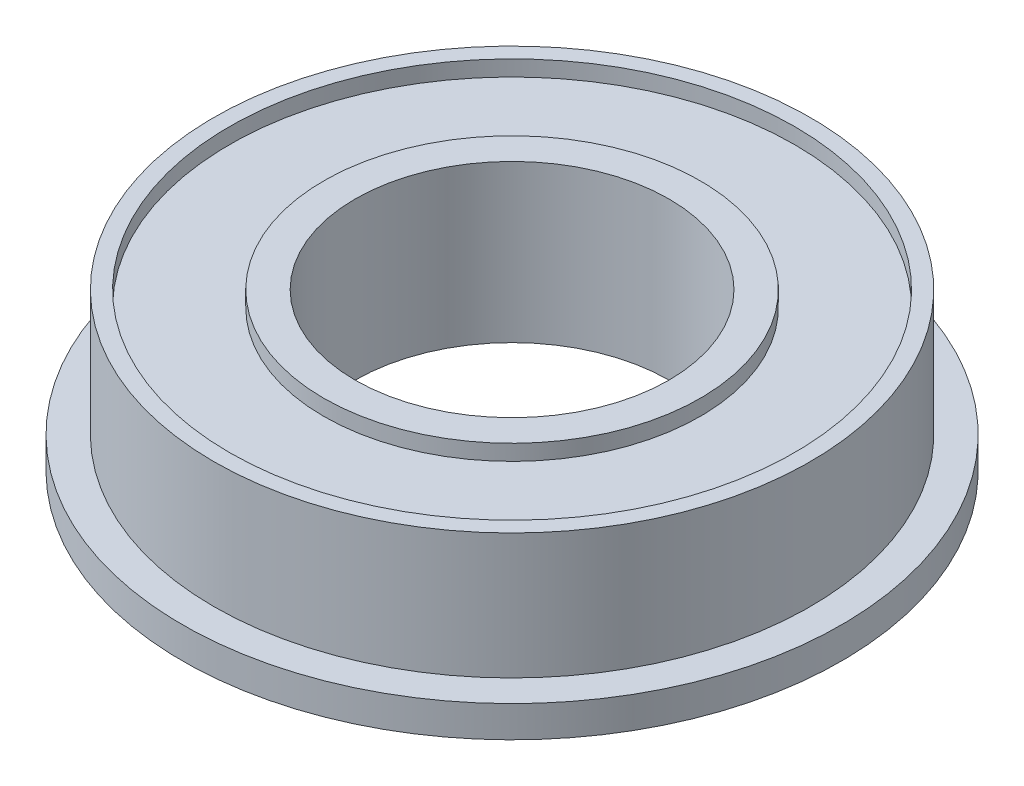
from build123d import *

# Parameters (mm, degrees)
SKETCH_1_R          = 9.5
EXTRUDE_1_DEPTH     = 4
SKETCH_2_R          = 10.5
EXTRUDE_2_DEPTH     = 1
CUT_EXTRUDE_1_REACH = 17.668
SKETCH_3_R          = 5
SKETCH_4_R          = 9
SKETCH_4_R_2        = 6
CUT_EXTRUDE_2_DEPTH = 0.5
CUT_EXTRUDE_START   = -4.5
SKETCH_4_2_R        = 9
SKETCH_4_2_R_2      = 6
CUT_EXTRUDE_5_DEPTH = 0.5


with BuildPart() as part:
    # 草图1 → 凸台-拉伸1 (new body)
    with BuildSketch(Plane(origin=(0, 0, 0), x_dir=(1, 0, 0), z_dir=(0, 1, 0))):
        with Locations(Location((0, 0, 0), (0, 0, 270))):
            Circle(SKETCH_1_R)
    extrude(amount=EXTRUDE_1_DEPTH)

    # 草图2 → 凸台-拉伸2 (add)
    with BuildSketch(Plane.XZ):
        with Locations(Location((0, 0, 0), (0, 0, 270))):
            Circle(SKETCH_2_R)
    extrude(amount=EXTRUDE_2_DEPTH)

    # 草图3 → 切除-拉伸1 (cut, up to next)
    with BuildSketch(Plane(origin=(0, 4, 0), x_dir=(1, 0, 0), z_dir=(0, 1, 0)), mode=Mode.PRIVATE) as cut_extrude_1_sk1:
        with Locations(Location((0, 0, 0), (0, 0, 270))):
            Circle(SKETCH_3_R)
    cut_extrude_1_tool1 = extrude(cut_extrude_1_sk1.sketch, amount=-CUT_EXTRUDE_1_REACH, mode=Mode.PRIVATE) & part.part
    add(cut_extrude_1_tool1.solids().sort_by_distance((0, 4, 0))[0], mode=Mode.SUBTRACT)

    # 草图4 → 切除-拉伸2 (cut)
    with BuildSketch(Plane(origin=(0, 4, 0), x_dir=(1, 0, 0), z_dir=(0, 1, 0))):
        with Locations(Location((0, 0, 0), (0, 0, 270))):
            Circle(SKETCH_4_R)
        with Locations(Location((0, 0, 0), (0, 0, 270))):
            Circle(SKETCH_4_R_2, mode=Mode.SUBTRACT)
    extrude(amount=-CUT_EXTRUDE_2_DEPTH, mode=Mode.SUBTRACT)

    # 草图4<2> → 切除-拉伸5 (cut)
    with BuildSketch(Plane(origin=(0, 4, 0), x_dir=(1, 0, 0), z_dir=(0, 1, 0)).offset(CUT_EXTRUDE_START)):
        with Locations(Location((0, 0, 0), (0, 0, 270))):
            Circle(SKETCH_4_2_R)
        with Locations(Location((0, 0, 0), (0, 0, 270))):
            Circle(SKETCH_4_2_R_2, mode=Mode.SUBTRACT)
    extrude(amount=-CUT_EXTRUDE_5_DEPTH, mode=Mode.SUBTRACT)


solid = part.part
